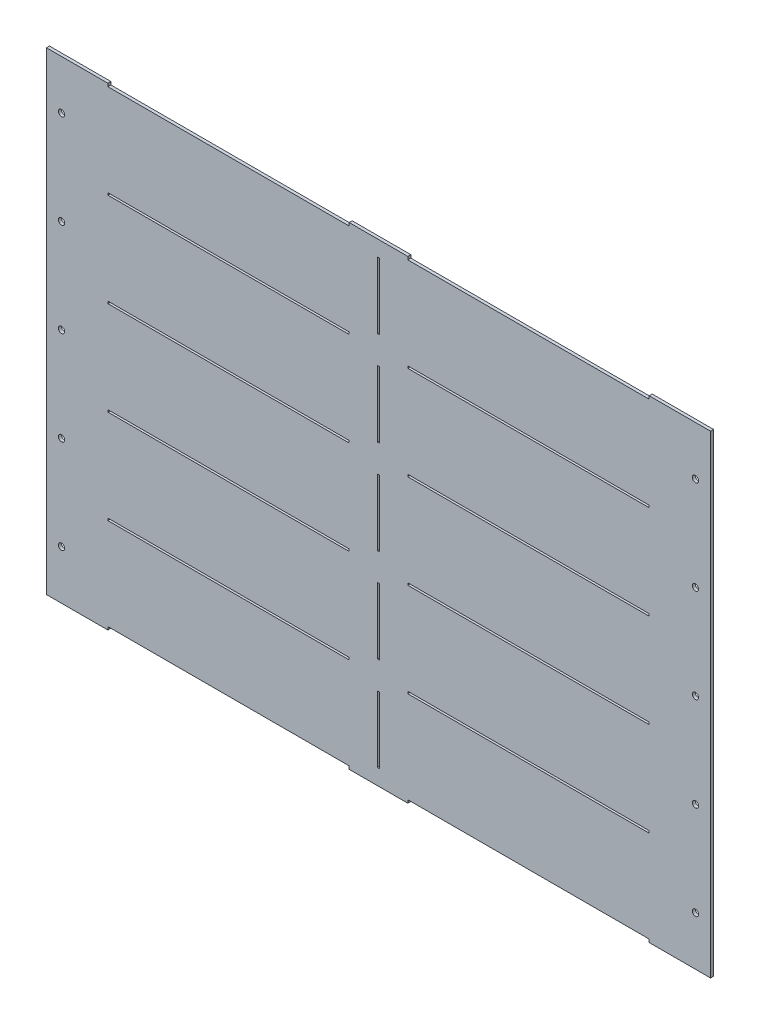
from build123d import *

# Parameters (mm, degrees)
MASTER_SKETCH_W         = 635.3556
MASTER_SKETCH_H         = 498.348
BOSS_EXTRUDE1_DEPTH     = 3.175
SKETCH2_W               = 31.75
SKETCH2_H               = 498.348
BOSS_EXTRUDE2_DEPTH     = 3.175
M6_CLEARANCE_HOLE1_D    = 6.6
SKETCH5_W               = 2.286
SKETCH5_H               = 69.85
CUT_EXTRUDE1_DEPTH      = 430.182420788
LPATTERN1_COUNT         = 5
LPATTERN1_PITCH         = 98.8568
SKETCH6_W               = 254
SKETCH6_H               = 3.175
CUT_EXTRUDE2_DEPTH      = 430.182420788
SKETCH7_W               = 254
SKETCH7_H               = 2.286
CUT_EXTRUDE3_DEPTH      = 430.182420788
LPATTERN2_COUNT         = 4
LPATTERN2_PITCH         = 98.8568
MIRROR4_COPY_1_SKETCH_W = 254
MIRROR4_COPY_1_SKETCH_H = 2.286
MIRROR4_COPY_1_DEPTH    = 430.182420788
MIRROR4_COPY_2_SKETCH_W = 254
MIRROR4_COPY_2_SKETCH_H = 2.286
MIRROR4_COPY_2_DEPTH    = 430.182420788
MIRROR4_COPY_3_SKETCH_W = 254
MIRROR4_COPY_3_SKETCH_H = 2.286
MIRROR4_COPY_3_DEPTH    = 430.182420788


with BuildPart() as part:
    # Master Sketch → Boss-Extrude1 (new body)
    with BuildSketch(Plane.XY):
        Rectangle(MASTER_SKETCH_W, MASTER_SKETCH_H)
    extrude(amount=BOSS_EXTRUDE1_DEPTH)

    # Sketch2 → Boss-Extrude2 (add)
    with BuildSketch(Plane.XY.offset(3.175)):
        with Locations((-333.5528, 0)):
            Rectangle(SKETCH2_W, SKETCH2_H)
    boss_extrude2 = extrude(amount=-BOSS_EXTRUDE2_DEPTH)

    # M6 Clearance Hole1 (through all)
    with Locations(Plane.XY.offset(3.175)):
        with Locations((-333.5528, -197.612), (-333.5528, -98.806), (-333.5528, 0), (-333.5528, 98.806), (-333.5528, 197.612)):
            m6_clearance_hole1 = Hole(M6_CLEARANCE_HOLE1_D / 2)

    # Mirror1: Boss-Extrude2, M6 Clearance Hole1 across plane
    add(boss_extrude2.mirror(Plane(origin=(0, 0, 0), x_dir=(0, 0, 1), z_dir=(1, 0, 0))))
    add(m6_clearance_hole1.mirror(Plane(origin=(0, 0, 0), x_dir=(0, 0, 1), z_dir=(1, 0, 0))), mode=Mode.SUBTRACT)

    # Sketch5 → Cut-Extrude1 (cut, through all)
    with BuildSketch(Plane.XY.offset(3.175)):
        with Locations((0, 197.7136)):
            Rectangle(SKETCH5_W, SKETCH5_H)
    cut_extrude1 = extrude(amount=-CUT_EXTRUDE1_DEPTH, mode=Mode.SUBTRACT)

    # LPattern1: Cut-Extrude1 ×5
    with Locations(*[(0, -i * LPATTERN1_PITCH, 0) for i in range(1, LPATTERN1_COUNT)]):
        add(cut_extrude1, mode=Mode.SUBTRACT)

    # Sketch6 → Cut-Extrude2 (cut, through all)
    with BuildSketch(Plane.XY.offset(3.175)):
        with Locations((-157.8229, 247.5865)):
            Rectangle(SKETCH6_W, SKETCH6_H)
        with Locations((157.8229, 247.5865)):
            Rectangle(SKETCH6_W, SKETCH6_H)
    cut_extrude2 = extrude(amount=-CUT_EXTRUDE2_DEPTH, mode=Mode.SUBTRACT)

    # Mirror3: Cut-Extrude2 across plane
    add(cut_extrude2.mirror(Plane.ZX), mode=Mode.SUBTRACT)

    # Sketch7 → Cut-Extrude3 (cut, through all)
    with BuildSketch(Plane.XY.offset(3.175)):
        with Locations((-157.8229, 148.2852)):
            Rectangle(SKETCH7_W, SKETCH7_H)
    cut_extrude3 = extrude(amount=-CUT_EXTRUDE3_DEPTH, mode=Mode.SUBTRACT)

    # LPattern2: Cut-Extrude3 ×4
    with Locations(*[(0, -i * LPATTERN2_PITCH, 0) for i in range(1, LPATTERN2_COUNT)]):
        add(cut_extrude3, mode=Mode.SUBTRACT)

    # Mirror4: Cut-Extrude3 across plane
    add(cut_extrude3.mirror(Plane(origin=(0, 0, 0), x_dir=(0, 0, 1), z_dir=(1, 0, 0))), mode=Mode.SUBTRACT)

    # Mirror4 copy 1 sketch → Mirror4 copy 1 (cut, through all)
    with BuildSketch(Plane(origin=(0, -98.8568, 3.175), x_dir=(-1, 0, 0), z_dir=(0, 0, 1))):
        with Locations((-157.8229, -148.2852)):
            Rectangle(MIRROR4_COPY_1_SKETCH_W, MIRROR4_COPY_1_SKETCH_H)
    extrude(amount=-MIRROR4_COPY_1_DEPTH, mode=Mode.SUBTRACT)

    # Mirror4 copy 2 sketch → Mirror4 copy 2 (cut, through all)
    with BuildSketch(Plane(origin=(0, -197.7136, 3.175), x_dir=(-1, 0, 0), z_dir=(0, 0, 1))):
        with Locations((-157.8229, -148.2852)):
            Rectangle(MIRROR4_COPY_2_SKETCH_W, MIRROR4_COPY_2_SKETCH_H)
    extrude(amount=-MIRROR4_COPY_2_DEPTH, mode=Mode.SUBTRACT)

    # Mirror4 copy 3 sketch → Mirror4 copy 3 (cut, through all)
    with BuildSketch(Plane(origin=(0, -296.5704, 3.175), x_dir=(-1, 0, 0), z_dir=(0, 0, 1))):
        with Locations((-157.8229, -148.2852)):
            Rectangle(MIRROR4_COPY_3_SKETCH_W, MIRROR4_COPY_3_SKETCH_H)
    extrude(amount=-MIRROR4_COPY_3_DEPTH, mode=Mode.SUBTRACT)


solid = part.part
